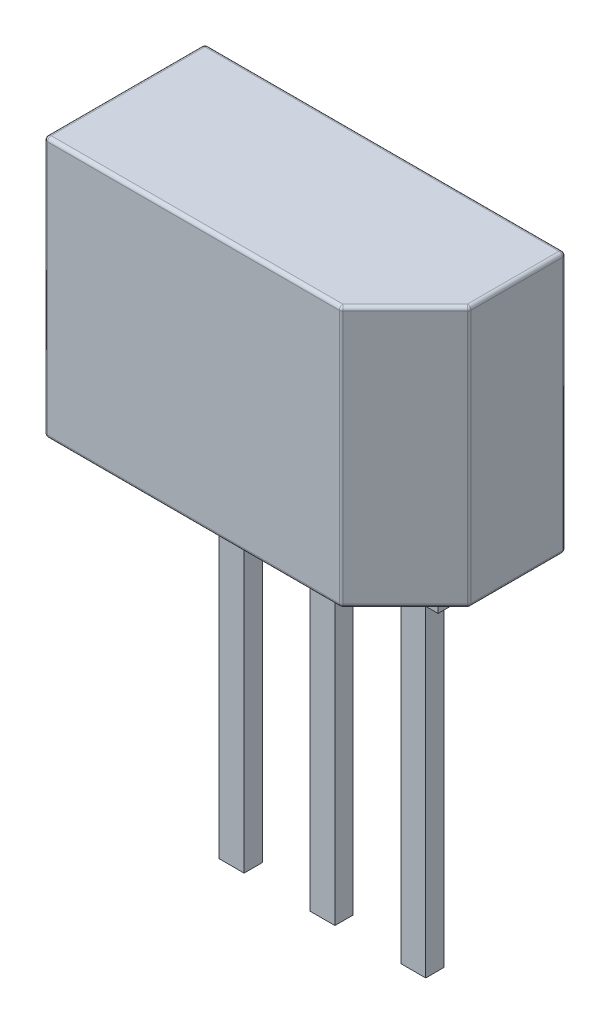
from build123d import *

# Parameters (mm, degrees)
SKIZZE1_W                       = 10.1
SKIZZE1_H                       = 4.5
AUFSATZ_LINEAR_AUSTRAGEN1_DEPTH = 7.3
FASE2_SIZE                      = 1.8
AUFSATZ_LINEAR_AUSTRAGEN2_DEPTH = 0.255
LINEARES_MUSTER1_COUNT          = 2
LINEARES_MUSTER1_PITCH          = 2.54
LINEARES_MUSTER1_COL_COUNT      = 2
LINEARES_MUSTER1_COL_PITCH      = 2.54
VERRUNDUNG1_R                   = 0.1


with BuildPart() as part:
    # Skizze1 → Aufsatz-Linear austragen1 (new body)
    with BuildSketch(Plane(origin=(0, 0, 0), x_dir=(1, 0, 0), z_dir=(0, 1, 0))):
        Rectangle(SKIZZE1_W, SKIZZE1_H)
    extrude(amount=AUFSATZ_LINEAR_AUSTRAGEN1_DEPTH)

    # Fase2
    fase2_edges = [part.edges().sort_by_distance(p)[0] for p in [
        (5.05, 3.65, 2.25),
    ]]
    chamfer(fase2_edges, length=FASE2_SIZE)

    # Skizze3 → Aufsatz-Linear austragen2 (add, symmetric)
    with BuildSketch(Plane.XY.offset(-0.745)):
        Polygon((0, 0), (-0.698236912, 0), (-0.698236912, -1.502157044), (-0.349118456, -1.502157044), (-0.349118456, -10.505351049), (0.346596575, -10.505351049), (0.346596575, -1.502157044), (0.692124121, -1.502157044), (0.692124121, 0), align=None)
    aufsatz_linear_austragen2 = extrude(amount=AUFSATZ_LINEAR_AUSTRAGEN2_DEPTH, both=True)

    # Lineares Muster1: Aufsatz-Linear austragen2 ×2
    with Locations(*[(i * LINEARES_MUSTER1_PITCH, 0, 0) for i in range(1, LINEARES_MUSTER1_COUNT)]):
        add(aufsatz_linear_austragen2)

    # Lineares Muster1 col: Aufsatz-Linear austragen2 ×2
    with Locations(*[(-i * LINEARES_MUSTER1_COL_PITCH, 0, 0) for i in range(1, LINEARES_MUSTER1_COL_COUNT)]):
        add(aufsatz_linear_austragen2)

    # Verrundung1
    verrundung1_edges = [part.edges().sort_by_distance(p)[0] for p in [
        (-5.05, 7.3, 0),
        (-0.9, 7.3, 2.25),
        (5.05, 0, -0.9),
        (5.05, 7.3, -0.9),
        (5.05, 3.65, 0.45),
        (4.15, 0, 1.35),
        (3.25, 3.65, 2.25),
        (4.15, 7.3, 1.35),
        (0.692124121, 0, -0.745),
        (-0.698236912, 0, -0.745),
        (-0.003056396, 0, -1),
        (-0.003056396, 0, -0.49),
        (-1.847875879, 0, -0.745),
        (-0.9, 0, 2.25),
        (-3.238236912, 0, -0.745),
        (-2.543056396, 0, -1),
        (-2.543056396, 0, -0.49),
        (-5.05, 0, 0),
        (0, 0, -2.25),
        (3.232124121, 0, -0.745),
        (1.841763088, 0, -0.745),
        (2.536943604, 0, -1),
        (2.536943604, 0, -0.49),
        (0, 7.3, -2.25),
        (-5.05, 3.65, 2.25),
        (-5.05, 3.65, -2.25),
        (5.05, 3.65, -2.25),
    ]]
    fillet(verrundung1_edges, radius=VERRUNDUNG1_R)


solid = part.part
